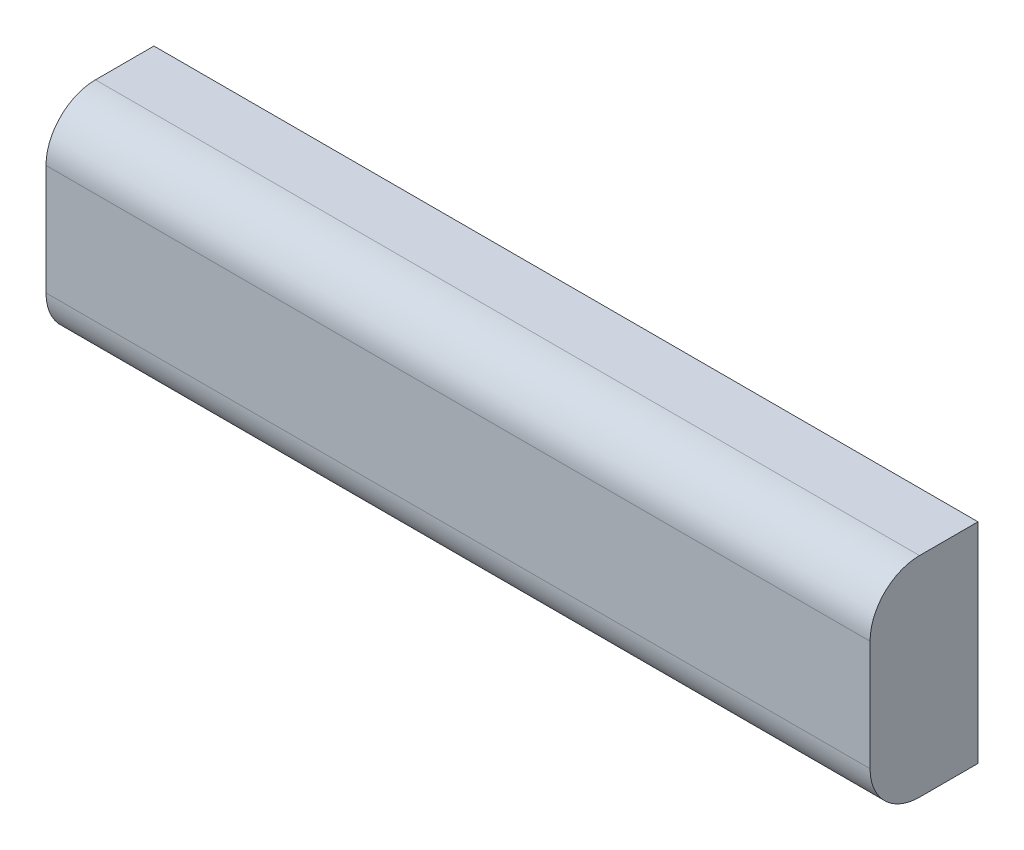
from build123d import *

# Parameters (mm, degrees)
SKETCH1_W           = 50
SKETCH1_H           = 12.7
BOSS_EXTRUDE1_DEPTH = 6.55
SKETCH2_W           = 48
SKETCH2_H           = 6.32
CUT_EXTRUDE2_DEPTH  = 6.35
FILLET1_R           = 3


with BuildPart() as part:
    # Sketch1 → Boss-Extrude1 (new body)
    with BuildSketch(Plane.XY):
        Rectangle(SKETCH1_W, SKETCH1_H)
    extrude(amount=BOSS_EXTRUDE1_DEPTH)

    # Sketch2 → Cut-Extrude2 (cut)
    with BuildSketch(Plane(origin=(0, 0, 0), x_dir=(-1, 0, 0), z_dir=(0, 0, -1))):
        Rectangle(SKETCH2_W, SKETCH2_H)
    extrude(amount=-CUT_EXTRUDE2_DEPTH, mode=Mode.SUBTRACT)

    # Fillet1
    fillet1_edges = [part.edges().sort_by_distance(p)[0] for p in [
        (0, 6.35, 6.55),
        (0, -6.35, 6.55),
    ]]
    fillet(fillet1_edges, radius=FILLET1_R)


solid = part.part
